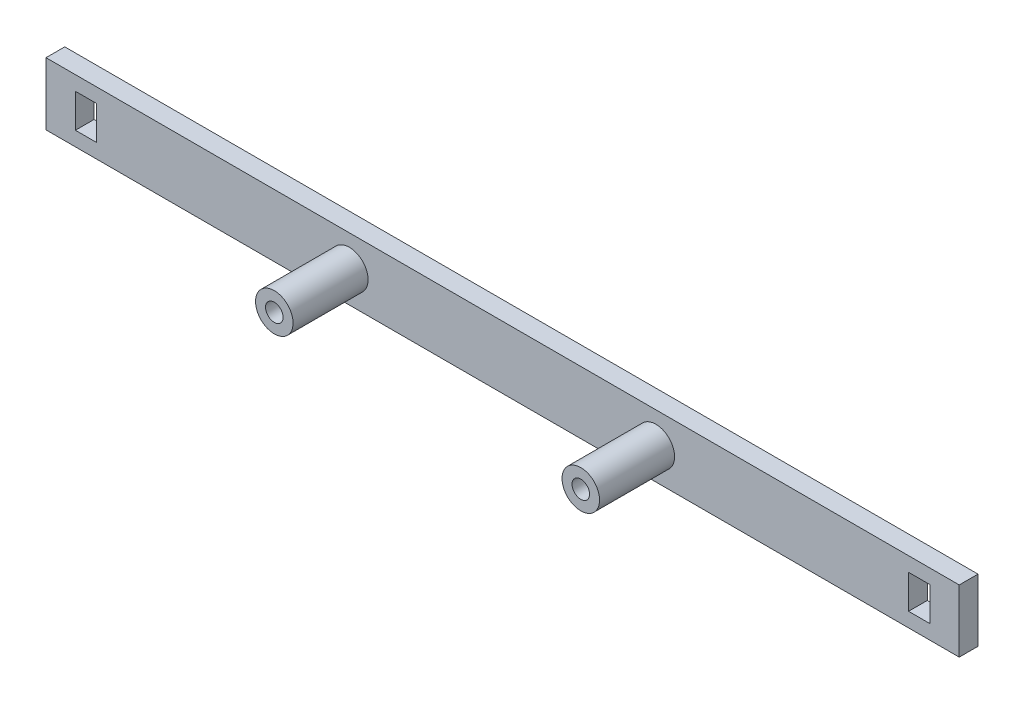
from build123d import *

# Parameters (mm, degrees)
SKETCH_1_W                = 146
SKETCH_1_H                = 10
EXTRUDE_146X10_DEPTH      = 3
F_12MM_START              = 3
SKETCH_2_R                = 3
F_12MM_DEPTH              = 12
M2P5_DEPTH                = 75.692703794
M2P5_DEPTH_BACK           = 75.692703794
SKETCH_3_R                = 1.4
CUT_EXTRUDE_M3_DEPTH      = 75.692703794
CUT_EXTRUDE_M3_DEPTH_BACK = 75.692703794
SKETCH_4_W                = 3.4
SKETCH_4_H                = 5.4


with BuildPart() as part:
    # 草图1 → 主板轻量横条146x10 (new body)
    with BuildSketch(Plane.XY):
        Rectangle(SKETCH_1_W, SKETCH_1_H)
    extrude(amount=EXTRUDE_146X10_DEPTH)

    # 草图2 → 主板12mm支柱 (add)
    with BuildSketch(Plane.XY.offset(F_12MM_START)):
        with Locations((-24.5, 0)):
            Circle(SKETCH_2_R)
        with Locations((24.5, 0)):
            Circle(SKETCH_2_R)
    extrude(amount=F_12MM_DEPTH)

    # 草图3 → 主板M2p5通孔 (cut, two sides: drawn at the far end of the back side and taken through both)
    with BuildSketch(Plane.XY.offset(-M2P5_DEPTH_BACK)):
        with Locations((-24.5, 0)):
            Circle(SKETCH_3_R)
        with Locations((24.5, 0)):
            Circle(SKETCH_3_R)
    extrude(amount=M2P5_DEPTH + M2P5_DEPTH_BACK, mode=Mode.SUBTRACT)

    # 草图4 → 梁上M3调节槽 (cut, two sides: drawn at the far end of the back side and taken through both)
    with BuildSketch(Plane.XY.offset(-CUT_EXTRUDE_M3_DEPTH_BACK)):
        with Locations((-66.6, 0)):
            Rectangle(SKETCH_4_W, SKETCH_4_H)
        with Locations((66.6, 0)):
            Rectangle(SKETCH_4_W, SKETCH_4_H)
    extrude(amount=CUT_EXTRUDE_M3_DEPTH + CUT_EXTRUDE_M3_DEPTH_BACK, mode=Mode.SUBTRACT)


solid = part.part
